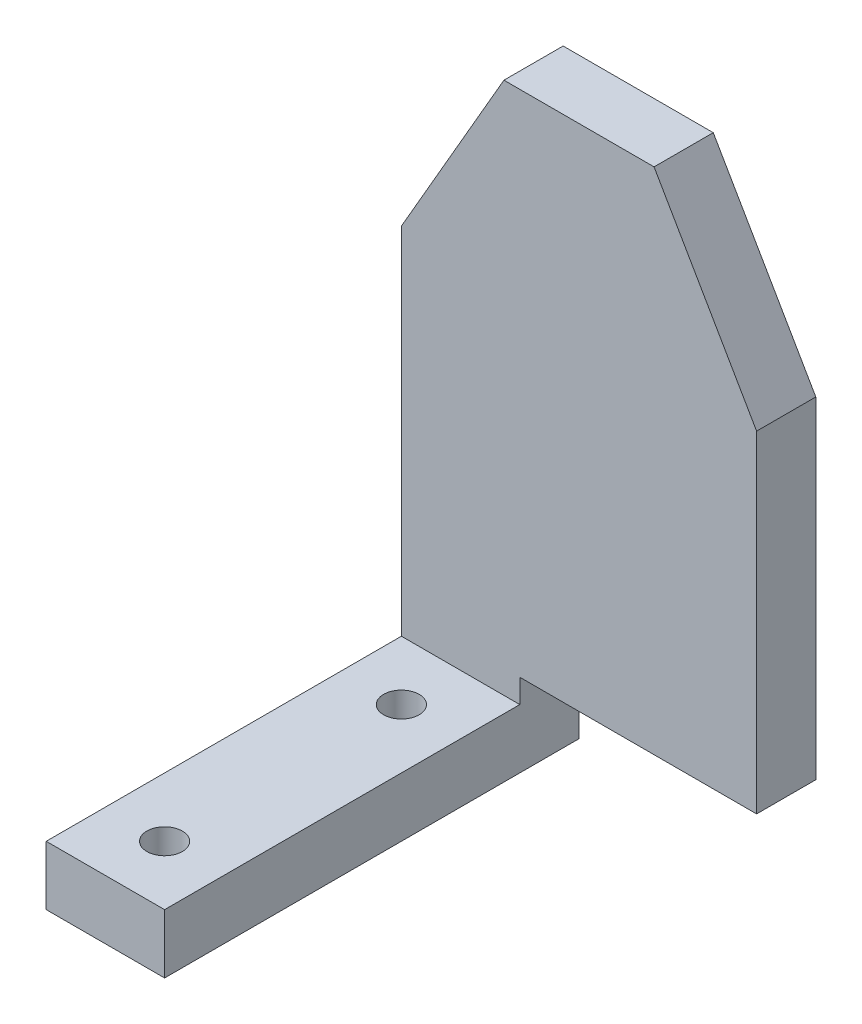
from build123d import *

# Parameters (mm, degrees)
BOSS_EXTRUDE1_DEPTH = 5
SKETCH2_W           = 10
SKETCH2_H           = 5
BOSS_EXTRUDE2_DEPTH = 30
SKETCH3_R           = 1.5
CUT_EXTRUDE1_DEPTH  = 5
SKETCH4_W           = 20
SKETCH4_H           = 7
CUT_EXTRUDE2_DEPTH  = 5


with BuildPart() as part:
    # Sketch1 → Boss-Extrude1 (new body)
    with BuildSketch(Plane.XY):
        Polygon((0, 35), (8.660254038, 50), (21.339745962, 50), (30, 35), (30, 0), (0, 0), align=None)
    extrude(amount=BOSS_EXTRUDE1_DEPTH)

    # Sketch2 → Boss-Extrude2 (add)
    with BuildSketch(Plane.XY.offset(5)):
        with Locations((5, 2.5)):
            Rectangle(SKETCH2_W, SKETCH2_H)
    extrude(amount=BOSS_EXTRUDE2_DEPTH)

    # Sketch3 → Cut-Extrude1 (cut)
    with BuildSketch(Plane(origin=(0, 5, 0), x_dir=(1, 0, 0), z_dir=(0, 1, 0))):
        with Locations(Location((5, -10, 0), (0, 0, 270))):
            Circle(SKETCH3_R)
        with Locations(Location((5, -30, 0), (0, 0, 270))):
            Circle(SKETCH3_R)
    extrude(amount=-CUT_EXTRUDE1_DEPTH, mode=Mode.SUBTRACT)

    # Sketch4 → Cut-Extrude2 (cut)
    with BuildSketch(Plane.XY.offset(5)):
        with Locations((20, 3.5)):
            Rectangle(SKETCH4_W, SKETCH4_H)
    extrude(amount=-CUT_EXTRUDE2_DEPTH, mode=Mode.SUBTRACT)


solid = part.part
